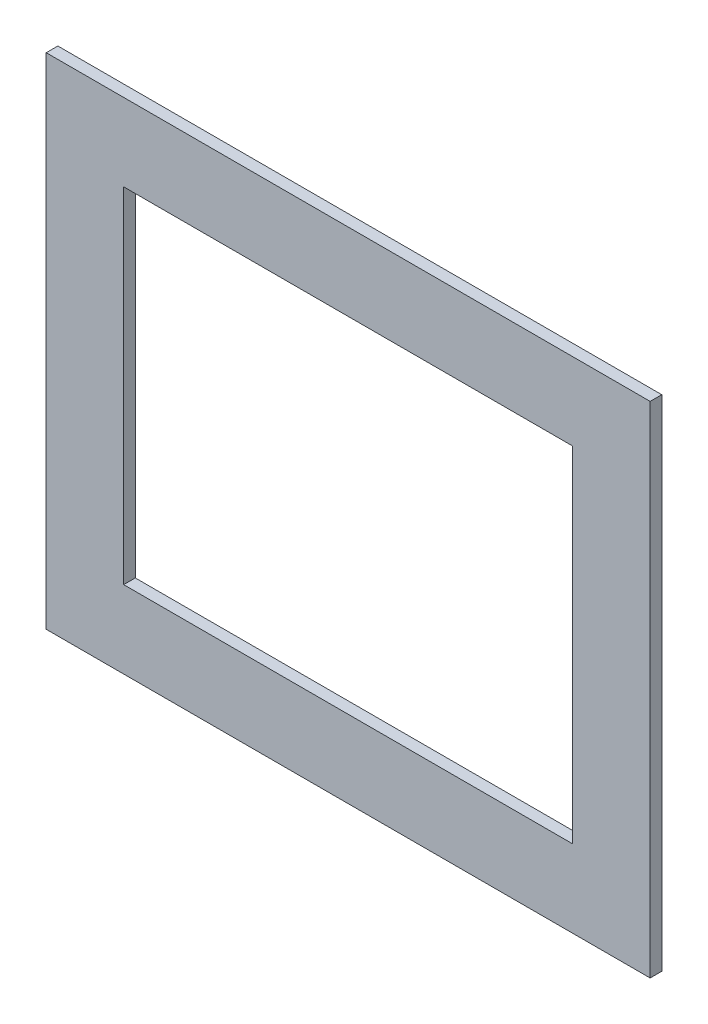
from build123d import *

# Parameters (mm, degrees)
SKETCH2_W           = 156
SKETCH2_H           = 129
SKETCH2_W_2         = 116
SKETCH2_H_2         = 89
BOSS_EXTRUDE1_DEPTH = 3


with BuildPart() as part:
    # Sketch2 → Boss-Extrude1 (new body)
    with BuildSketch(Plane.XY.offset(2)):
        with Locations((-75, 62.5)):
            Rectangle(SKETCH2_W, SKETCH2_H)
        with Locations((-75, 62.5)):
            Rectangle(SKETCH2_W_2, SKETCH2_H_2, mode=Mode.SUBTRACT)
    extrude(amount=BOSS_EXTRUDE1_DEPTH)


solid = part.part
